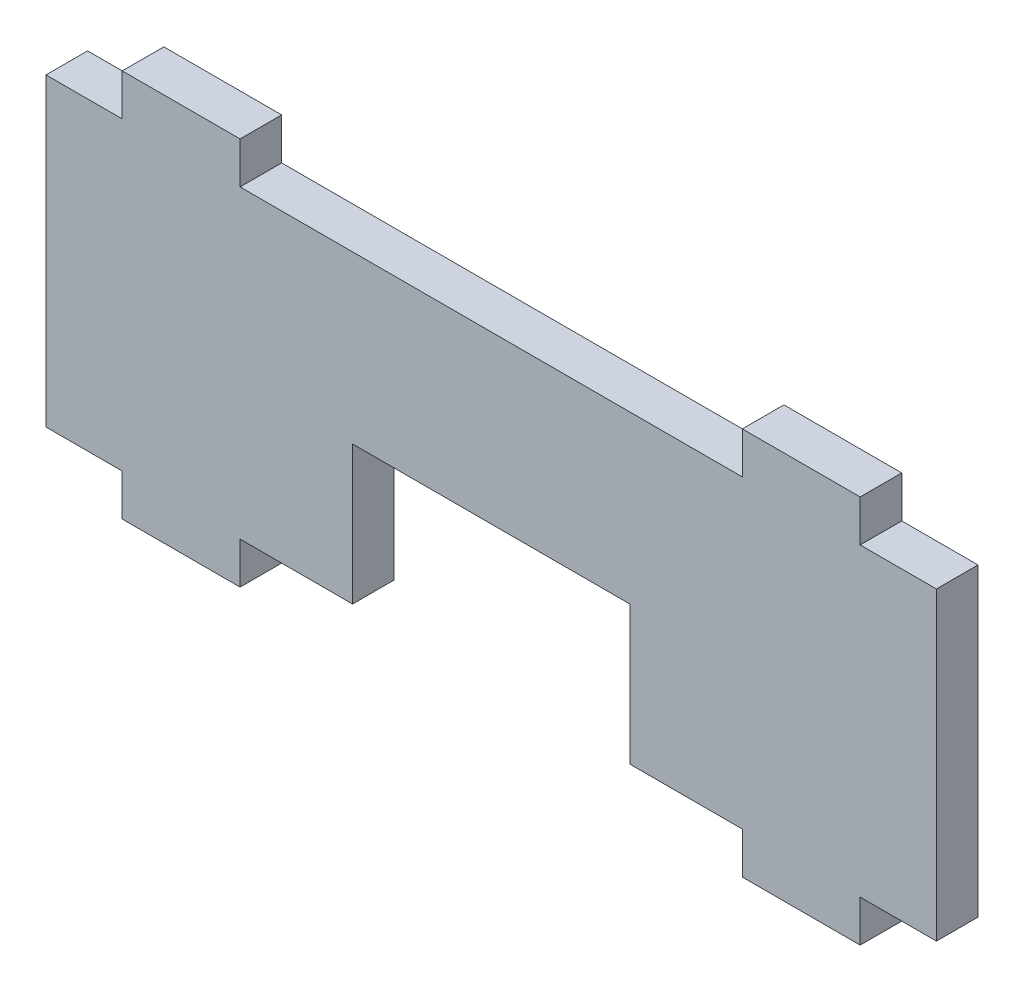
from build123d import *

# Parameters (mm, degrees)
SALIENTE_EXTRUIR1_DEPTH = 3


with BuildPart() as part:
    # Croquis1 → Saliente-Extruir1 (new body)
    with BuildSketch(Plane.XY):
        Polygon((3, 0), (8.5, 0), (8.5, -3), (17, -3), (17, 0), (25.115, 0), (25.115, 10), (45.115, 10), (45.115, 0), (53.23, 0), (53.23, -3), (61.73, -3), (61.73, 0), (67.23, 0), (67.23, 22), (61.73, 22), (61.73, 25), (53.23, 25), (53.23, 22), (17, 22), (17, 25), (8.5, 25), (8.5, 22), (3, 22), align=None)
    extrude(amount=SALIENTE_EXTRUIR1_DEPTH)


solid = part.part
